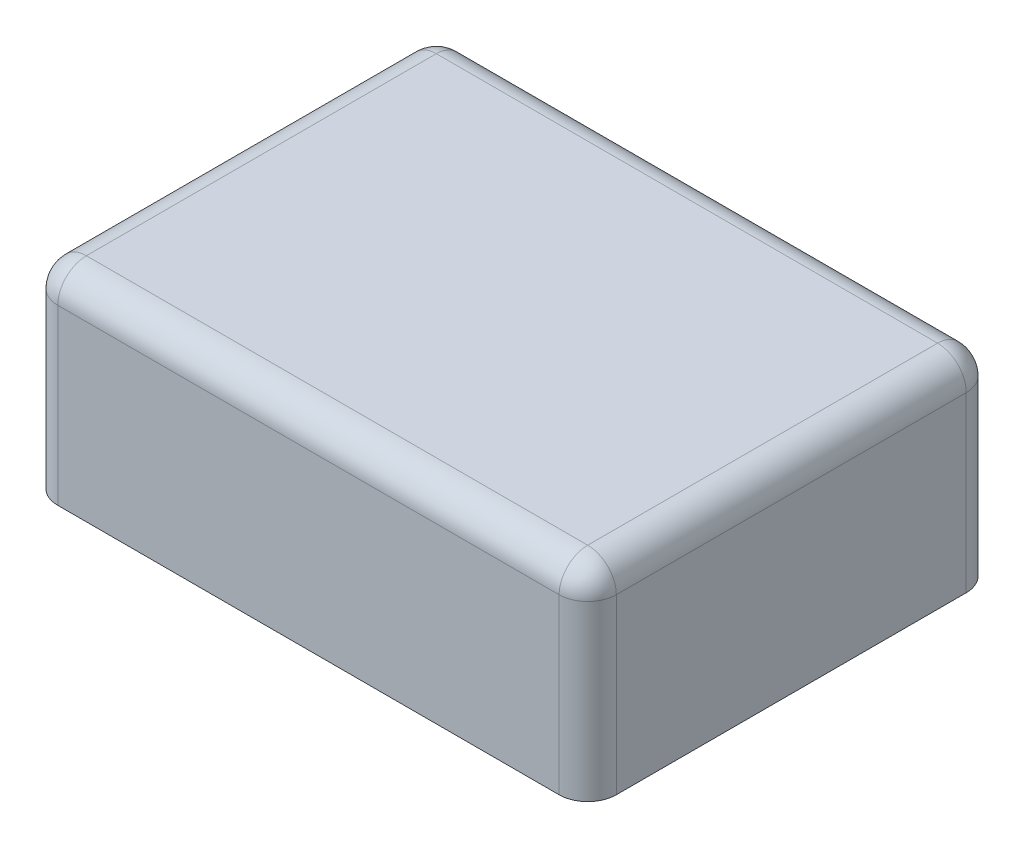
from build123d import *

# Parameters (mm, degrees)
BOSS_EXTRUDE1_DEPTH = 15.24
BOSS_EXTRUDE2_START = -1.27
BOSS_EXTRUDE2_DEPTH = 1.27
FILLET1_R           = 2.159


with BuildPart() as part:
    # Sketch1 → Boss-Extrude1 (new body)
    with BuildSketch(Plane(origin=(0, 0, 0), x_dir=(1, 0, 0), z_dir=(0, 1, 0))):
        with BuildLine():
            ThreePointArc((0.889, 29.464), (-0.637643541, 28.831643541), (-1.27, 27.305))
            Line((-1.27, 27.305), (-1.27, 0.889))
            ThreePointArc((-1.27, 0.889), (-0.637643541, -0.637643541), (0.889, -1.27))
            Line((0.889, -1.27), (38.735, -1.27))
            ThreePointArc((38.735, -1.27), (40.261643541, -0.637643541), (40.894, 0.889))
            Line((40.894, 0.889), (40.894, 27.305))
            ThreePointArc((40.894, 27.305), (40.261643541, 28.831643541), (38.735, 29.464))
            Line((38.735, 29.464), (0.889, 29.464))
        make_face()
        with BuildLine():
            Line((38.735, 0), (0.889, 0))
            ThreePointArc((0.889, 0), (0.260382072, 0.260382072), (0, 0.889))
            Line((0, 0.889), (0, 27.305))
            ThreePointArc((0, 27.305), (0.260382072, 27.933617928), (0.889, 28.194))
            Line((0.889, 28.194), (38.735, 28.194))
            ThreePointArc((38.735, 28.194), (39.363617928, 27.933617928), (39.624, 27.305))
            Line((39.624, 27.305), (39.624, 0.889))
            ThreePointArc((39.624, 0.889), (39.363617928, 0.260382072), (38.735, 0))
        make_face(mode=Mode.SUBTRACT)
    extrude(amount=BOSS_EXTRUDE1_DEPTH)

    # Sketch2 → Boss-Extrude2 (add)
    with BuildSketch(Plane(origin=(0, 15.24, 0), x_dir=(1, 0, 0), z_dir=(0, 1, 0)).offset(BOSS_EXTRUDE2_START)):
        with BuildLine():
            Line((38.735, 28.194), (0.889, 28.194))
            ThreePointArc((0.889, 28.194), (0.260382072, 27.933617928), (0, 27.305))
            Line((0, 27.305), (0, 0.889))
            ThreePointArc((0, 0.889), (0.260382072, 0.260382072), (0.889, 0))
            Line((0.889, 0), (38.735, 0))
            ThreePointArc((38.735, 0), (39.363617928, 0.260382072), (39.624, 0.889))
            Line((39.624, 0.889), (39.624, 27.305))
            ThreePointArc((39.624, 27.305), (39.363617928, 27.933617928), (38.735, 28.194))
        make_face()
    extrude(amount=BOSS_EXTRUDE2_DEPTH)

    # Fillet1
    fillet1_edges = [part.edges().sort_by_distance(p)[0] for p in [
        (19.812, 15.24, -29.464),
        (40.261643541, 15.24, -28.831643541),
        (40.894, 15.24, -14.097),
        (40.261643541, 15.24, 0.637643541),
        (19.812, 15.24, 1.27),
        (-0.637643541, 15.24, 0.637643541),
        (-1.27, 15.24, -14.097),
        (-0.637643541, 15.24, -28.831643541),
    ]]
    fillet(fillet1_edges, radius=FILLET1_R)


solid = part.part
